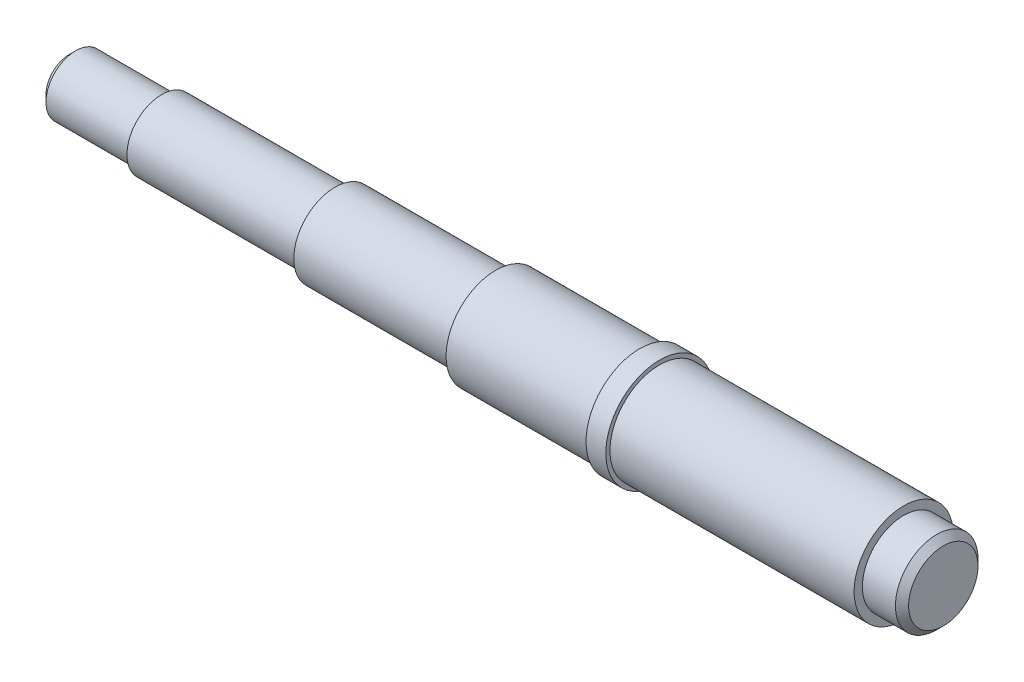
from build123d import *

# Parameters (mm, degrees)
CHAMFER_1_SIZE      = 2
CUT_EXTRUDE_START   = -11.5
SKETCH_2_W          = 25
SKETCH_2_H          = 4
CUT_EXTRUDE_1_DEPTH = 28


with BuildPart() as part:
    # 草图1 → 旋转1 (revolve)
    with BuildSketch(Plane.XY, mode=Mode.PRIVATE) as revolve_1_sk:
        Polygon((0, 0), (0, 9), (28, 9), (28, 10.5), (80.5, 10.5), (80.5, 12.5), (129.1, 12.5), (129.1, 15), (172.7, 15), (172.7, 16.25), (178.7, 16.25), (178.7, 15), (252.6, 15), (252.6, 12.5), (264.6, 12.5), (264.6, 0), align=None)
    revolve(revolve_1_sk.sketch.rotate(Axis((264.6, 0, 0), (-1, 0, 0)), 90), axis=Axis((264.6, 0, 0), (-1, 0, 0)))

    # 倒角1
    chamfer_1_edges = [part.edges().sort_by_distance(p)[0] for p in [
        (264.6, 0, 12.5),
        (0, 0, 9),
    ]]
    chamfer(chamfer_1_edges, length=CHAMFER_1_SIZE)

    # 草图2 → 切除-拉伸1 (cut)
    with BuildSketch(Plane.XY.offset(CUT_EXTRUDE_START)):
        with Locations((150.9, -2)):
            Rectangle(SKETCH_2_W, SKETCH_2_H)
        with Locations((150.9, 2)):
            Rectangle(SKETCH_2_W, SKETCH_2_H)
    extrude(amount=-CUT_EXTRUDE_1_DEPTH, mode=Mode.SUBTRACT)


solid = part.part
